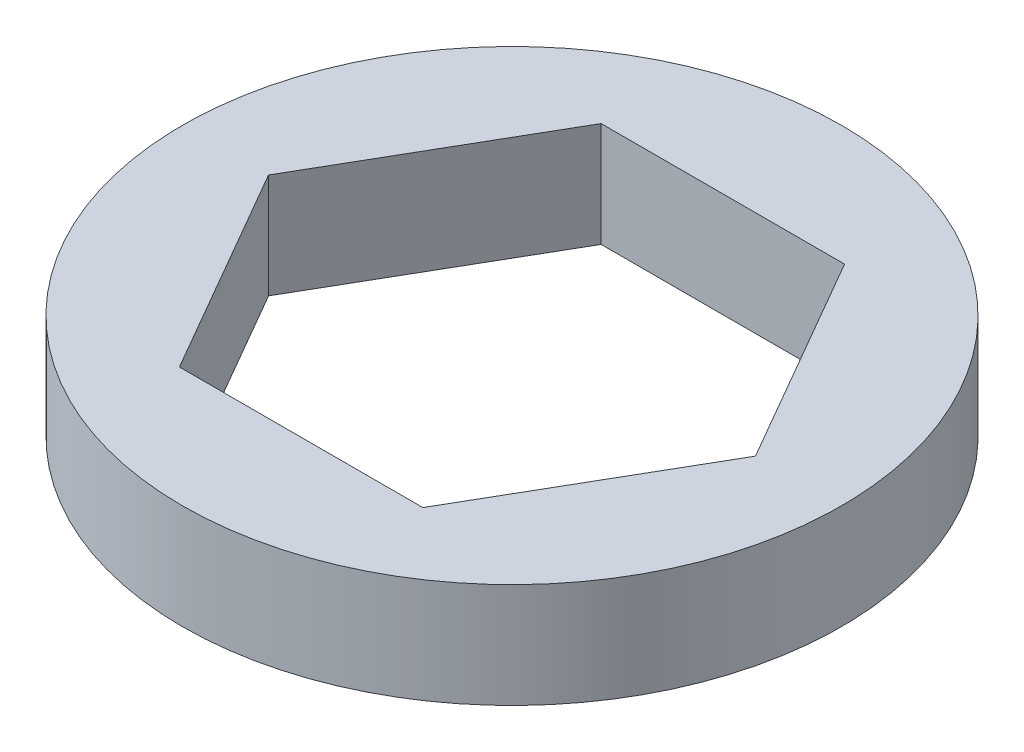
from build123d import *

# Parameters (mm, degrees)
SKETCH1_R           = 9.9949
BOSS_EXTRUDE1_DEPTH = 3.175


with BuildPart() as part:
    # Sketch1 → Boss-Extrude1 (new body)
    with BuildSketch(Plane(origin=(0, 0, 0), x_dir=(1, 0, 0), z_dir=(0, 1, 0))):
        with Locations(Location((0, 0, 0), (0, 0, 270))):
            Circle(SKETCH1_R)
        Polygon((7.383674858, 0), (3.691837429, 6.39445), (-3.691837429, 6.39445), (-7.383674858, 0), (-3.691837429, -6.39445), (3.691837429, -6.39445), align=None, mode=Mode.SUBTRACT)
    extrude(amount=BOSS_EXTRUDE1_DEPTH)


solid = part.part
